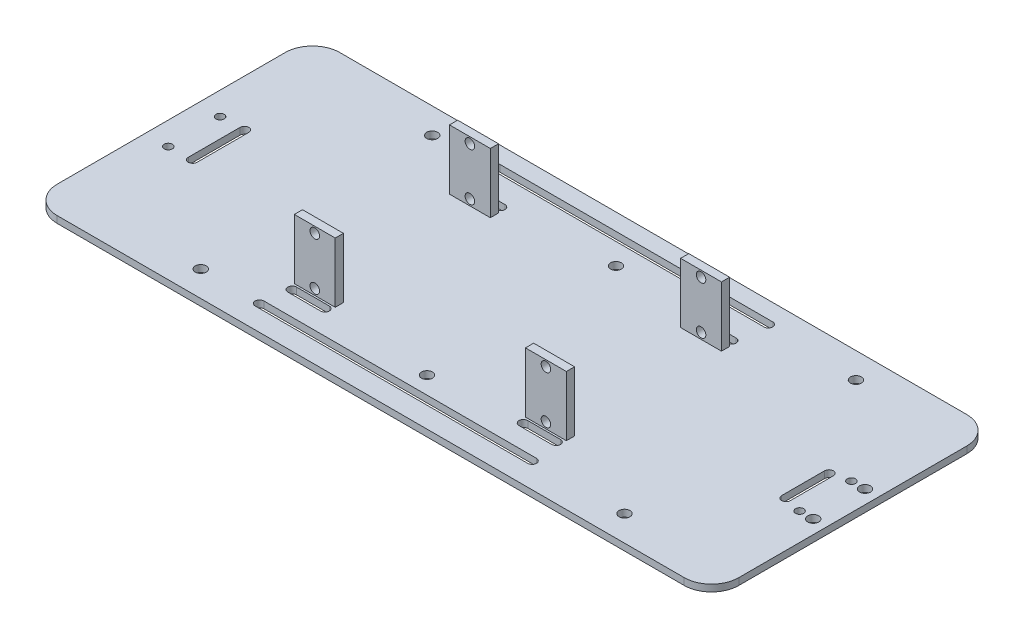
from build123d import *

# Parameters (mm, degrees)
SKETCH_1_R          = 2
SKETCH_1_R_2        = 1.5
SKETCH_1_W          = 83
SKETCH_1_H          = 53
EXTRUDE_1_DEPTH     = 1.25
SKETCH_1_3_W        = 83
SKETCH_1_3_H        = 53
EXTRUDE_2_DEPTH     = 1.25
SKETCH_3_W          = 15
SKETCH_3_H          = 3
EXTRUDE_3_DEPTH     = 22
SKETCH_4_R          = 1.75
CUT_EXTRUDE_1_DEPTH = 152.167018917


with BuildPart() as part:
    # 草图1 → 凸台-拉伸1 (new, symmetric)
    with BuildSketch(Plane(origin=(0, 0, 0), x_dir=(1, 0, 0), z_dir=(0, 1, 0))):
        with BuildLine():
            Line((115, -51.818763954), (-115, -51.818763954))
            ThreePointArc((-115, -51.818763954), (-122.071067812, -48.889831766), (-125, -41.818763954))
            Line((-125, -41.818763954), (-125, 41.818763954))
            ThreePointArc((-125, 41.818763954), (-122.071067812, 48.889831766), (-115, 51.818763954))
            Line((-115, 51.818763954), (115, 51.818763954))
            ThreePointArc((115, 51.818763954), (122.071067812, 48.889831766), (125, 41.818763954))
            Line((125, 41.818763954), (125, -41.818763954))
            ThreePointArc((125, -41.818763954), (122.071067812, -48.889831766), (115, -51.818763954))
        make_face()
        with Locations(Location((120, 9.5, 0), (0, 0, 270))):
            Circle(SKETCH_1_R, mode=Mode.SUBTRACT)
        with Locations(Location((120, -9.5, 0), (0, 0, 270))):
            Circle(SKETCH_1_R, mode=Mode.SUBTRACT)
        with Locations(Location((115, 9.5, 0), (0, 0, 270))):
            Circle(SKETCH_1_R_2, mode=Mode.SUBTRACT)
        with Locations(Location((115, -9.5, 0), (0, 0, 270))):
            Circle(SKETCH_1_R_2, mode=Mode.SUBTRACT)
        with Locations(Location((-116.567558605, 9.5, 0), (0, 0, 270))):
            Circle(SKETCH_1_R_2, mode=Mode.SUBTRACT)
        with Locations(Location((-116.567558605, -9.5, 0), (0, 0, 270))):
            Circle(SKETCH_1_R_2, mode=Mode.SUBTRACT)
        with Locations(Location((-71.717926986, 42.44914331, 0), (0, 0, 270))):
            Circle(SKETCH_1_R, mode=Mode.SUBTRACT)
        with Locations(Location((3.471118404, 34.665138943, 0), (0, 0, 270))):
            Circle(SKETCH_1_R, mode=Mode.SUBTRACT)
        with Locations(Location((83.714889534, 42.44914331, 0), (0, 0, 270))):
            Circle(SKETCH_1_R, mode=Mode.SUBTRACT)
        with Locations(Location((83.714889534, -42.44914331, 0), (0, 0, 270))):
            Circle(SKETCH_1_R, mode=Mode.SUBTRACT)
        with Locations(Location((3.471118404, -34.665138943, 0), (0, 0, 270))):
            Circle(SKETCH_1_R, mode=Mode.SUBTRACT)
        with Locations(Location((-71.717926986, -42.44914331, 0), (0, 0, 270))):
            Circle(SKETCH_1_R, mode=Mode.SUBTRACT)
        with BuildLine():
            Line((-48.4, 33.818763954), (-36.4, 33.818763954))
            ThreePointArc((-36.4, 33.818763954), (-34.8, 32.218763954), (-36.4, 30.618763954))
            Line((-36.4, 30.618763954), (-48.4, 30.618763954))
            ThreePointArc((-48.4, 30.618763954), (-50, 32.218763954), (-48.4, 33.818763954))
        make_face(mode=Mode.SUBTRACT)
        with BuildLine():
            Line((-48.4, -33.818763954), (-36.4, -33.818763954))
            ThreePointArc((-36.4, -33.818763954), (-34.8, -32.218763954), (-36.4, -30.618763954))
            Line((-36.4, -30.618763954), (-48.4, -30.618763954))
            ThreePointArc((-48.4, -30.618763954), (-50, -32.218763954), (-48.4, -33.818763954))
        make_face(mode=Mode.SUBTRACT)
        with BuildLine():
            Line((48.4, -33.818763954), (36.4, -33.818763954))
            ThreePointArc((36.4, -33.818763954), (34.8, -32.218763954), (36.4, -30.618763954))
            Line((36.4, -30.618763954), (48.4, -30.618763954))
            ThreePointArc((48.4, -30.618763954), (50, -32.218763954), (48.4, -33.818763954))
        make_face(mode=Mode.SUBTRACT)
        with BuildLine():
            Line((48.4, 33.818763954), (36.4, 33.818763954))
            ThreePointArc((36.4, 33.818763954), (34.8, 32.218763954), (36.4, 30.618763954))
            Line((36.4, 30.618763954), (48.4, 30.618763954))
            ThreePointArc((48.4, 30.618763954), (50, 32.218763954), (48.4, 33.818763954))
        make_face(mode=Mode.SUBTRACT)
        with Locations((48.772829551, 0)):
            Rectangle(SKETCH_1_W, SKETCH_1_H, mode=Mode.SUBTRACT)
        with BuildLine():
            Line((-50, -41.019413621), (50, -41.019413621))
            ThreePointArc((50, -41.019413621), (51.6, -42.619413621), (50, -44.219413621))
            Line((50, -44.219413621), (-50, -44.219413621))
            ThreePointArc((-50, -44.219413621), (-51.6, -42.619413621), (-50, -41.019413621))
        make_face(mode=Mode.SUBTRACT)
        with BuildLine():
            Line((-50, 42.44914331), (50, 42.44914331))
            ThreePointArc((50, 42.44914331), (51.6, 44.04914331), (50, 45.64914331))
            Line((50, 45.64914331), (-50, 45.64914331))
            ThreePointArc((-50, 45.64914331), (-51.6, 44.04914331), (-50, 42.44914331))
        make_face(mode=Mode.SUBTRACT)
        with BuildLine():
            Line((110, 7.8731375), (110, -7.8731375))
            ThreePointArc((110, -7.8731375), (108.4, -9.4731375), (106.8, -7.8731375))
            Line((106.8, -7.8731375), (106.8, 7.8731375))
            ThreePointArc((106.8, 7.8731375), (108.4, 9.4731375), (110, 7.8731375))
        make_face(mode=Mode.SUBTRACT)
        with BuildLine():
            Line((-106.302001896, 9.756482491), (-106.302001896, -9.243517509))
            ThreePointArc((-106.302001896, -9.243517509), (-107.902001896, -10.843517509), (-109.502001896, -9.243517509))
            Line((-109.502001896, -9.243517509), (-109.502001896, 9.756482491))
            ThreePointArc((-109.502001896, 9.756482491), (-107.902001896, 11.356482491), (-106.302001896, 9.756482491))
        make_face(mode=Mode.SUBTRACT)
    extrude(amount=EXTRUDE_1_DEPTH, both=True)

    # 草图1<3> → 凸台-拉伸2 (add, symmetric)
    with BuildSketch(Plane(origin=(0, 0, 0), x_dir=(1, 0, 0), z_dir=(0, 1, 0))):
        with Locations((48.772829551, 0)):
            Rectangle(SKETCH_1_3_W, SKETCH_1_3_H)
    extrude(amount=EXTRUDE_2_DEPTH, both=True)

    # 草图3 → 凸台-拉伸3 (add)
    with BuildSketch(Plane(origin=(0, 1.25, 0), x_dir=(1, 0, 0), z_dir=(0, 1, 0))):
        with Locations((-42.391446381, -28.448620181)):
            Rectangle(SKETCH_3_W, SKETCH_3_H)
        with Locations((-42.391446381, 28.448620181)):
            Rectangle(SKETCH_3_W, SKETCH_3_H)
        with Locations((42.391446381, -28.448620181)):
            Rectangle(SKETCH_3_W, SKETCH_3_H)
        with Locations((42.391446381, 28.448620181)):
            Rectangle(SKETCH_3_W, SKETCH_3_H)
    extrude(amount=EXTRUDE_3_DEPTH)

    # 草图4 → 切除-拉伸1 (cut, through all)
    with BuildSketch(Plane.XY.offset(29.948620181)):
        with Locations((-42.391446381, 21)):
            Circle(SKETCH_4_R)
        with Locations((-42.391446381, 3.5)):
            Circle(SKETCH_4_R)
    cut_extrude_1 = extrude(amount=-CUT_EXTRUDE_1_DEPTH, mode=Mode.SUBTRACT)

    # 镜向1: 切除-拉伸1 across plane
    add(cut_extrude_1.mirror(Plane(origin=(0, 0, 0), x_dir=(0, 0, 1), z_dir=(1, 0, 0))), mode=Mode.SUBTRACT)


solid = part.part
